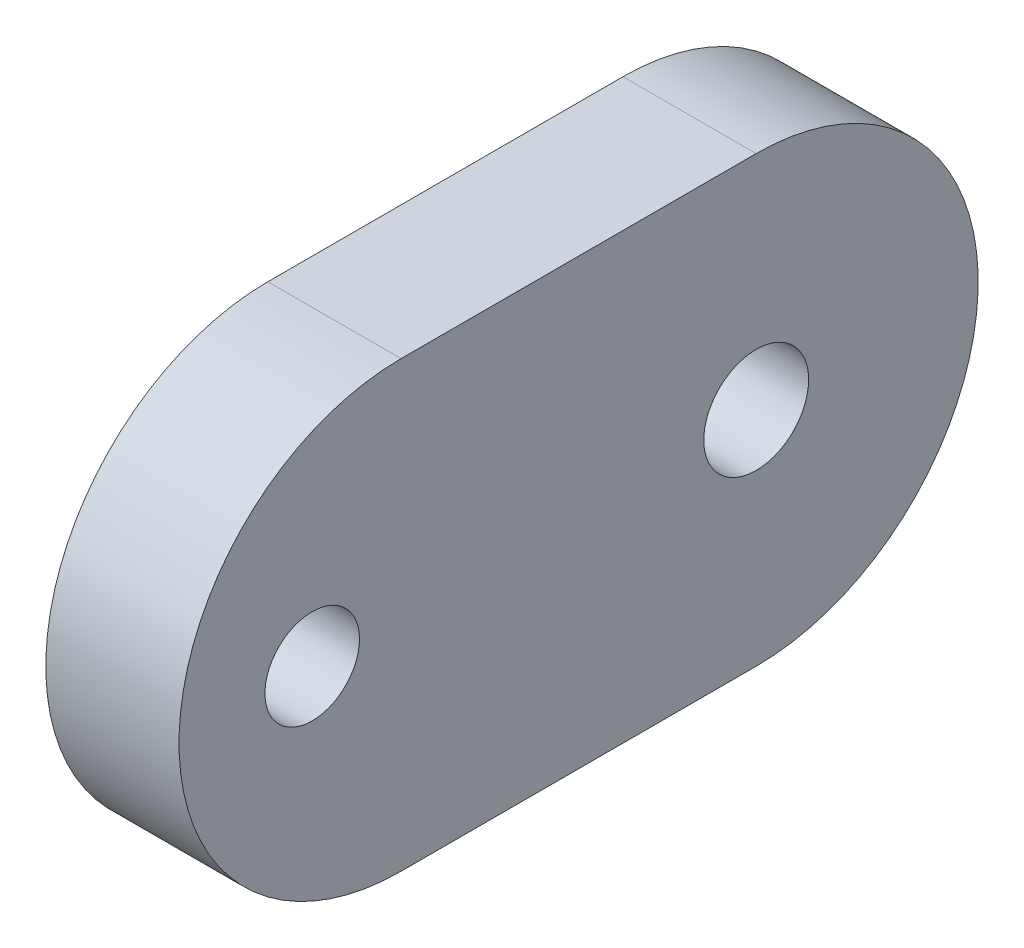
from build123d import *

# Parameters (mm, degrees)
BOSS_EXTRUDE1_DEPTH   = 3.81
F_6_32_TAPPED_HOLE1_D = 2.7051
F_3_0MM_DOWEL_HOLE1_D = 3


with BuildPart() as part:
    # Sketch1 → Boss-Extrude1 (new body)
    with BuildSketch(Plane(origin=(0, 0, 0), x_dir=(0, 0, -1), z_dir=(1, 0, 0))):
        with BuildLine():
            Line((0, 0), (10.16, 0))
            ThreePointArc((10.16, 0), (16.51, 6.35), (10.16, 12.7))
            Line((10.16, 12.7), (0, 12.7))
            ThreePointArc((0, 12.7), (-6.35, 6.35), (0, 0))
        make_face()
    extrude(amount=BOSS_EXTRUDE1_DEPTH)

    # #6-32 Tapped Hole1 (through all)
    with Locations(Plane(origin=(3.81, 0, 0), x_dir=(0, 0, -1), z_dir=(1, 0, 0))):
        with Locations((-2.54, 6.35)):
            Hole(F_6_32_TAPPED_HOLE1_D / 2)

    # Ø3.0mm Dowel Hole1 (through all)
    with Locations(Plane(origin=(3.81, 0, 0), x_dir=(0, 0, -1), z_dir=(1, 0, 0))):
        with Locations((10.16, 6.35)):
            Hole(F_3_0MM_DOWEL_HOLE1_D / 2)


solid = part.part
